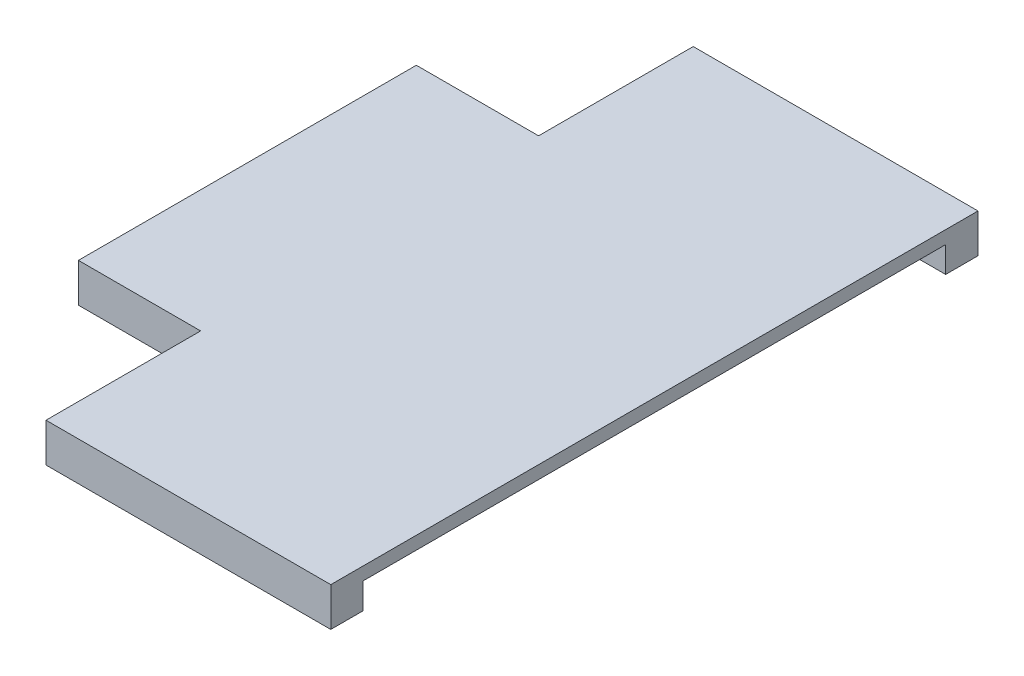
from build123d import *

# Parameters (mm, degrees)
EXTRUDE_1_DEPTH     = 6
CUT_EXTRUDE_2_DEPTH = 4


with BuildPart() as part:
    # Эскиз1 → Вытянуть1 (new body)
    with BuildSketch(Plane(origin=(0, 0, 0), x_dir=(1, 0, 0), z_dir=(0, 1, 0))):
        Polygon((-12, 0), (-56, 0), (-56, 23.893685267), (-74.88648833, 23.893685267), (-74.88648833, 76.106314733), (-56, 76.106314733), (-56, 100), (-12, 100), align=None)
    extrude(amount=EXTRUDE_1_DEPTH)

    # Эскиз2 → Вытянуть2 (cut)
    with BuildSketch(Plane.XZ):
        Polygon((-56, -5), (-12, -5), (-12, -95), (-56, -95), (-56, -73.28325794), (-74.88648833, -73.28325794), (-74.88648833, -26.71674206), (-56, -26.71674206), align=None)
    extrude(amount=-CUT_EXTRUDE_2_DEPTH, mode=Mode.SUBTRACT)


solid = part.part
